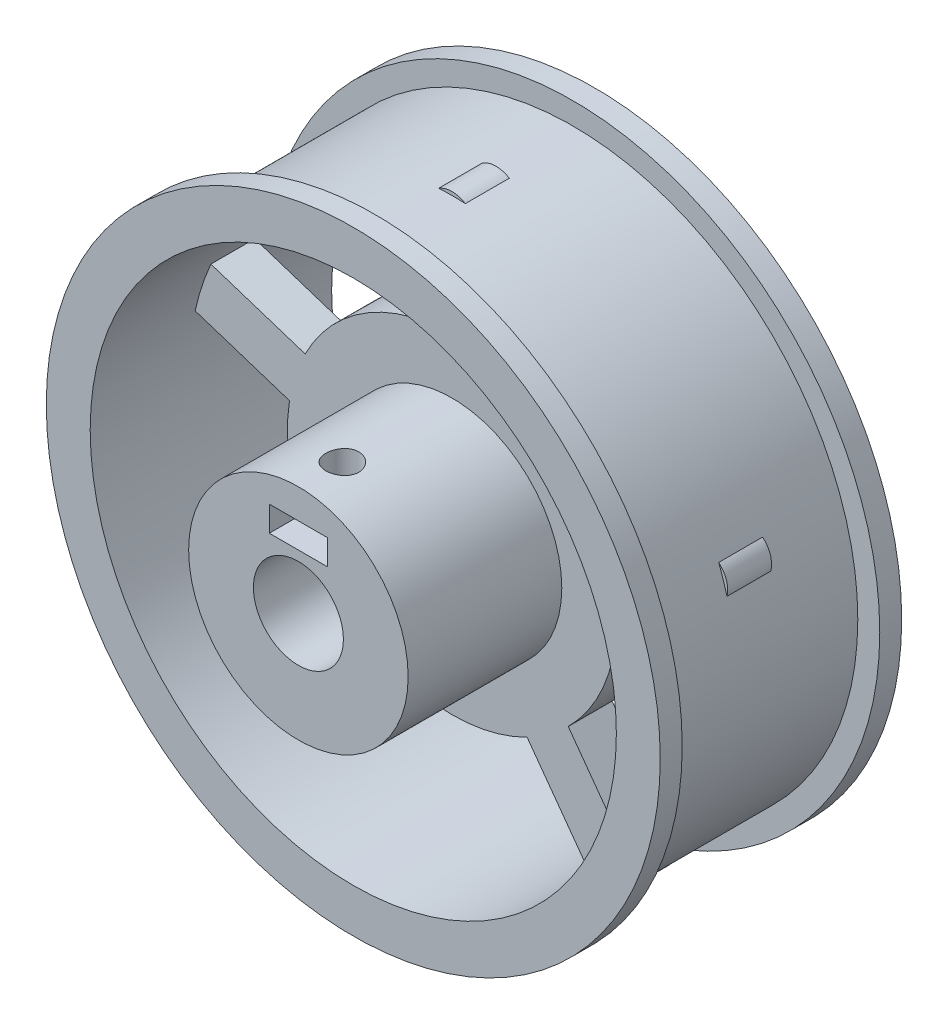
from build123d import *

# Parameters (mm, degrees)
BOSS_EXTRUDE1_DEPTH      = 2
BOSS_EXTRUDE1_DEPTH_BACK = 2
SKETCH3_R                = 15
BOSS_EXTRUDE2_DEPTH      = 16
BOSS_EXTRUDE2_DEPTH_BACK = 16
SKETCH6_R                = 10
CUT_EXTRUDE6_DEPTH       = 43.670158732
CUT_EXTRUDE6_DEPTH_BACK  = 43.670158732
SKETCH7_R                = 4.1
BOSS_EXTRUDE3_DEPTH      = 2
BOSS_EXTRUDE3_DEPTH_BACK = 2
SKETCH10_W               = 5.3
SKETCH10_H               = 2.3
CUT_EXTRUDE7_DEPTH       = 4
CUT_EXTRUDE8_START       = -4
SKETCH11_R               = 1.5
CUT_EXTRUDE8_DEPTH       = 10
CUT_EXTRUDE9_DEPTH       = 2.3


with BuildPart() as part:
    # Sketch2 → Revolve1 (revolve)
    with BuildSketch(Plane(origin=(0, 0, 0), x_dir=(0, 0, -1), z_dir=(1, 0, 0)), mode=Mode.PRIVATE) as revolve1_sk:
        Polygon((-9, 25.970899576), (9, 25.970899576), (9, 27.970899576), (11, 27.970899576), (11, 23.970899576), (-11, 23.970899576), (-11, 27.970899576), (-9, 27.970899576), align=None)
    revolve(revolve1_sk.sketch.rotate(Axis((0, 0, 10), (0, 0, -1)), 90), axis=Axis((0, 0, 10), (0, 0, -1)))



with BuildPart() as body_2:
    # Sketch3 → Boss-Extrude1 (new, two sides: drawn at the far end of the back side and taken through both)
    with BuildSketch(Plane.XY.offset(-BOSS_EXTRUDE1_DEPTH_BACK)):
        Circle(SKETCH3_R)
    extrude(amount=BOSS_EXTRUDE1_DEPTH + BOSS_EXTRUDE1_DEPTH_BACK)

    # Sketch6 → Boss-Extrude2 (add, two sides: drawn at the far end of the back side and taken through both)
    with BuildSketch(Plane.XY.offset(-BOSS_EXTRUDE2_DEPTH_BACK)):
        Circle(SKETCH6_R)
    extrude(amount=BOSS_EXTRUDE2_DEPTH + BOSS_EXTRUDE2_DEPTH_BACK)

    # Sketch7 → Cut-Extrude6 (cut, two sides: drawn at the far end of the back side and taken through both)
    with BuildSketch(Plane.XY.offset(-CUT_EXTRUDE6_DEPTH_BACK)):
        Circle(SKETCH7_R)
    extrude(amount=CUT_EXTRUDE6_DEPTH + CUT_EXTRUDE6_DEPTH_BACK, mode=Mode.SUBTRACT)


with BuildPart() as part_1:
    add(part.part)

    add(body_2.part)  # Boss-Extrude3 merges body 2
    # Sketch8 → Boss-Extrude3 (add, two sides: drawn at the far end of the back side and taken through both)
    with BuildSketch(Plane.XY.offset(-BOSS_EXTRUDE3_DEPTH_BACK)):
        with BuildLine():
            Line((-2.314963667, 11.983341333), (-2.314963667, 23.970899576))
            ThreePointArc((-2.314963667, 23.970899576), (0, 26.285863243), (2.314963667, 23.970899576))
            Line((2.314963667, 23.970899576), (2.314963667, 11.983341333))
            ThreePointArc((2.314963667, 11.983341333), (0, 9.668377666), (-2.314963667, 11.983341333))
        make_face()
        with BuildLine():
            Line((10.681471747, 5.904717401), (22.082317129, 9.60907662))
            ThreePointArc((22.082317129, 9.60907662), (24.999341523, 8.122778454), (23.513043358, 5.205754059))
            Line((23.513043358, 5.205754059), (12.112197976, 1.501394841))
            ThreePointArc((12.112197976, 1.501394841), (9.195173582, 2.987693007), (10.681471747, 5.904717401))
        make_face()
        with BuildLine():
            Line((8.916476256, -8.334025285), (15.962586203, -18.032163625))
            ThreePointArc((15.962586203, -18.032163625), (15.450442758, -21.265710075), (12.216896307, -20.75356663))
            Line((12.216896307, -20.75356663), (5.170786361, -11.055428291))
            ThreePointArc((5.170786361, -11.055428291), (5.682929806, -7.82188184), (8.916476256, -8.334025285))
        make_face()
        with BuildLine():
            Line((-5.170786361, -11.055428291), (-12.216896307, -20.75356663))
            ThreePointArc((-12.216896307, -20.75356663), (-15.450442758, -21.265710075), (-15.962586203, -18.032163625))
            Line((-15.962586203, -18.032163625), (-8.916476256, -8.334025285))
            ThreePointArc((-8.916476256, -8.334025285), (-5.682929806, -7.82188184), (-5.170786361, -11.055428291))
        make_face()
        with BuildLine():
            Line((-12.112197976, 1.501394841), (-23.513043358, 5.205754059))
            ThreePointArc((-23.513043358, 5.205754059), (-24.999341523, 8.122778454), (-22.082317129, 9.60907662))
            Line((-22.082317129, 9.60907662), (-10.681471747, 5.904717401))
            ThreePointArc((-10.681471747, 5.904717401), (-9.195173582, 2.987693007), (-12.112197976, 1.501394841))
        make_face()
    extrude(amount=BOSS_EXTRUDE3_DEPTH + BOSS_EXTRUDE3_DEPTH_BACK)

    # Sketch10 → Cut-Extrude7 (cut)
    with BuildSketch(Plane.XY.offset(12)):
        with Locations((0, 6.15)):
            Rectangle(SKETCH10_W, SKETCH10_H)
    cut_extrude7 = extrude(amount=CUT_EXTRUDE7_DEPTH, mode=Mode.SUBTRACT)

    # Sketch11 → Cut-Extrude8 (cut)
    with BuildSketch(Plane(origin=(0, 5, 0), x_dir=(1, 0, 0), z_dir=(0, 1, 0)).offset(CUT_EXTRUDE8_START)):
        with Locations((0, -12)):
            Circle(SKETCH11_R)
    cut_extrude8 = extrude(amount=CUT_EXTRUDE8_DEPTH, mode=Mode.SUBTRACT)

    # Sketch12 → Cut-Extrude9 (cut)
    with BuildSketch(Plane(origin=(0, 5, 0), x_dir=(1, 0, 0), z_dir=(0, 1, 0))):
        Polygon((0, -15.059956427), (2.65, -13.529978213), (2.65, -10.470021787), (0, -8.940043573), (-2.65, -10.470021787), (-2.65, -13.529978213), align=None)
    cut_extrude9 = extrude(amount=CUT_EXTRUDE9_DEPTH, mode=Mode.SUBTRACT)

    # Mirror1: Cut-Extrude7, Cut-Extrude8, Cut-Extrude9 across plane
    add(cut_extrude7.mirror(Plane.XY), mode=Mode.SUBTRACT)
    add(cut_extrude8.mirror(Plane.XY), mode=Mode.SUBTRACT)
    add(cut_extrude9.mirror(Plane.XY), mode=Mode.SUBTRACT)


solid = part_1.part
